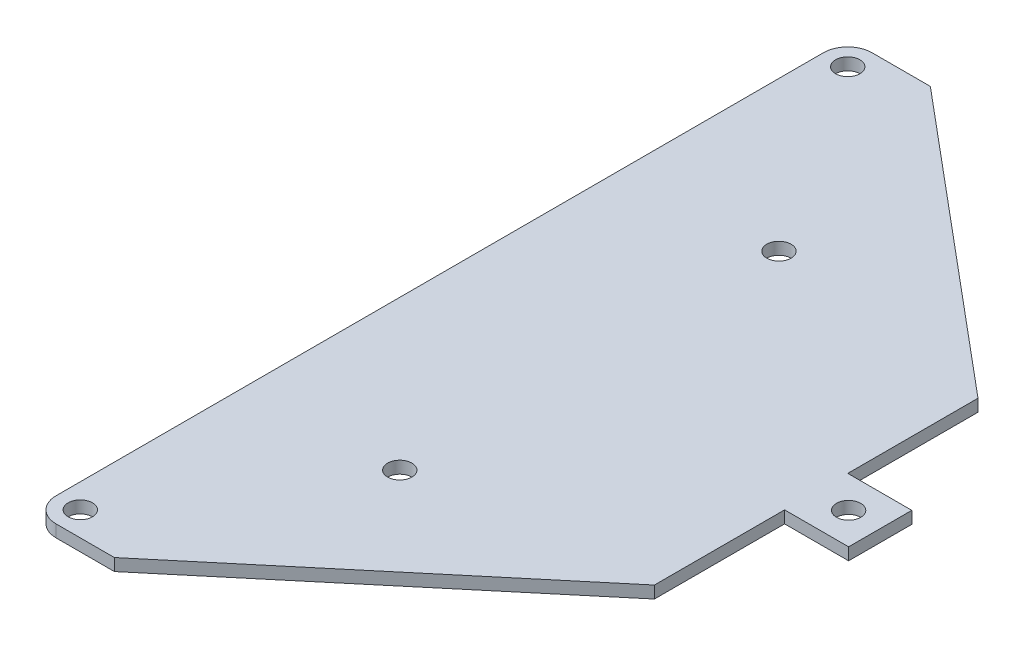
from build123d import *

# Parameters (mm, degrees)
CROQUIS1_R              = 1.5
SALIENTE_EXTRUIR1_DEPTH = 1.5


with BuildPart() as part:
    # Croquis1 → Saliente-Extruir1 (new body)
    with BuildSketch(Plane(origin=(0, 0, 0), x_dir=(1, 0, 0), z_dir=(0, 1, 0))):
        with BuildLine():
            Line((43.47, -43.46), (51.37, -43.46))
            Line((51.37, -43.46), (51.37, -51.26))
            Line((51.37, -51.26), (43.47, -51.26))
            Line((43.47, -51.26), (43.47, -67.33))
            Line((43.47, -67.33), (7.2, -97.72))
            Line((7.2, -97.72), (0, -97.72))
            ThreePointArc((0, -97.72), (-2.121320344, -96.841320344), (-3, -94.72))
            Line((-3, -94.72), (-3, 0))
            ThreePointArc((-3, 0), (-2.121320344, 2.121320344), (0, 3))
            Line((0, 3), (7.2, 3))
            Line((7.2, 3), (43.47, -27.39))
            Line((43.47, -27.39), (43.47, -43.46))
        make_face()
        with Locations(Location((0, 0, 0), (0, 0, 270))):
            Circle(CROQUIS1_R, mode=Mode.SUBTRACT)
        with Locations(Location((0, -94.72, 0), (0, 0, 270))):
            Circle(CROQUIS1_R, mode=Mode.SUBTRACT)
        with Locations(Location((47.47, -47.36, 0), (0, 0, 270))):
            Circle(CROQUIS1_R, mode=Mode.SUBTRACT)
        with Locations(Location((15.47, -23.96, 0), (0, 0, 270))):
            Circle(CROQUIS1_R, mode=Mode.SUBTRACT)
        with Locations(Location((15.47, -70.76, 0), (0, 0, 270))):
            Circle(CROQUIS1_R, mode=Mode.SUBTRACT)
    extrude(amount=SALIENTE_EXTRUIR1_DEPTH)


solid = part.part
